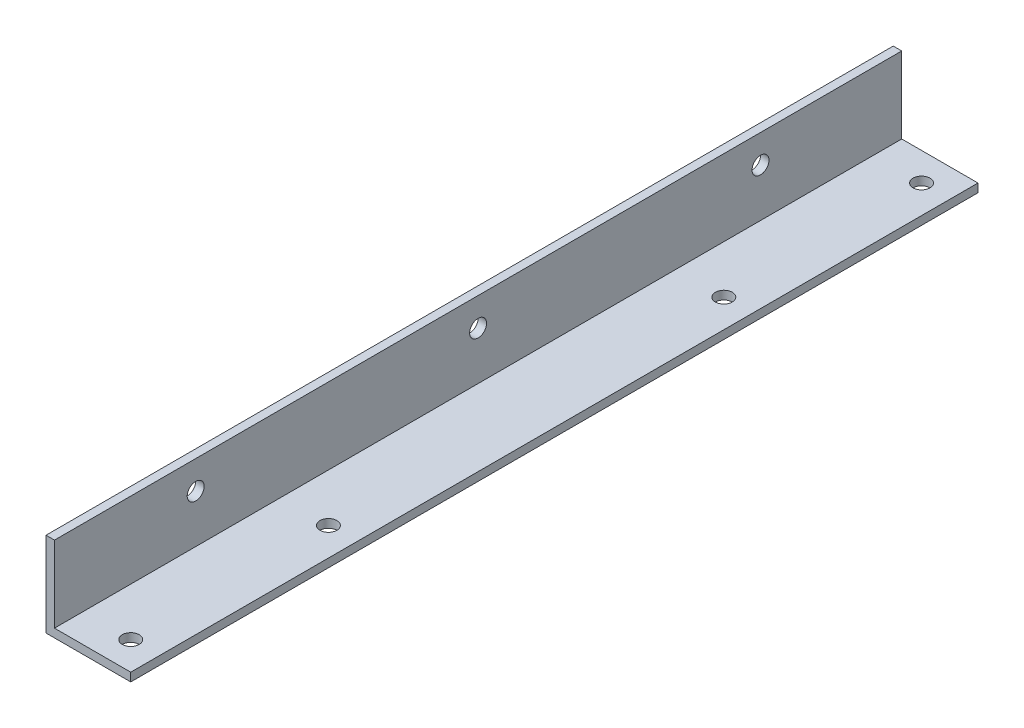
from build123d import *

# Parameters (mm, degrees)
EXTRUSION1_DEPTH           = 75
EXTRUSION1_DEPTH_BACK      = 75
ESQUISSE2_R                = 1.5
EXTRUSION2_DEPTH           = 78.667560796
ESQUISSE3_R                = 1.5
EXTRUSION3_DEPTH           = 78.942286341
R_P_TITION_LIN_AIRE1_COUNT = 3
R_P_TITION_LIN_AIRE1_PITCH = 50
R_P_TITION_LIN_AIRE2_COUNT = 5
R_P_TITION_LIN_AIRE2_PITCH = 35


with BuildPart() as part:
    # Esquisse1 → Extrusion1 (new, two sides: drawn at the far end of the back side and taken through both)
    with BuildSketch(Plane.XY.offset(-EXTRUSION1_DEPTH_BACK)):
        Polygon((0, 0), (2, 0), (15, 0), (15, 1.5), (1.5, 1.5), (1.5, 15), (0, 15), align=None)
    extrude(amount=EXTRUSION1_DEPTH + EXTRUSION1_DEPTH_BACK)

    # Esquisse2 → Extrusion2 (cut, through all)
    with BuildSketch(Plane(origin=(1.5, 0, 0), x_dir=(0, 0, -1), z_dir=(1, 0, 0))):
        with Locations((-50, 10)):
            Circle(ESQUISSE2_R)
    extrusion2 = extrude(amount=-EXTRUSION2_DEPTH, mode=Mode.SUBTRACT)

    # Esquisse3 → Extrusion3 (cut, through all)
    with BuildSketch(Plane.XZ):
        with Locations((10, 70)):
            Circle(ESQUISSE3_R)
    extrusion3 = extrude(amount=-EXTRUSION3_DEPTH, mode=Mode.SUBTRACT)

    # Répétition linéaire1: Extrusion2 ×3
    with Locations(*[(0, 0, -i * R_P_TITION_LIN_AIRE1_PITCH) for i in range(1, R_P_TITION_LIN_AIRE1_COUNT)]):
        add(extrusion2, mode=Mode.SUBTRACT)

    # Répétition linéaire2: Extrusion3 ×5, 1 skipped
    with Locations(*[(0, 0, -i * R_P_TITION_LIN_AIRE2_PITCH) for i in range(1, R_P_TITION_LIN_AIRE2_COUNT) if i not in (2,)]):
        add(extrusion3, mode=Mode.SUBTRACT)


solid = part.part
